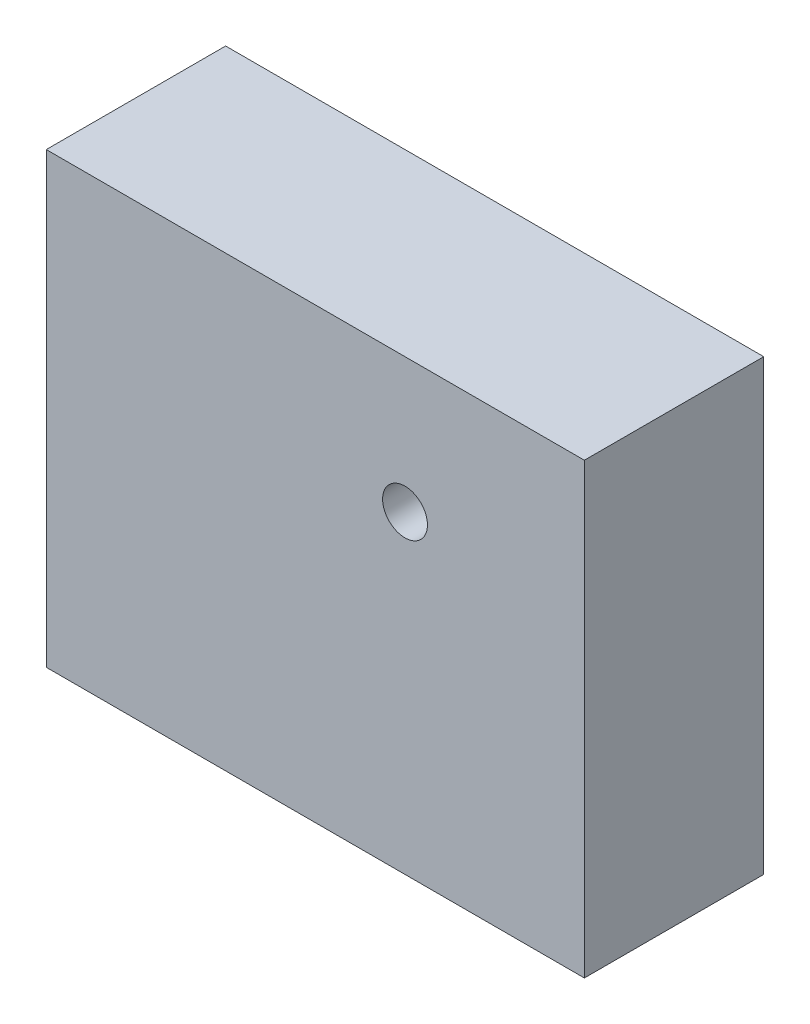
from build123d import *

# Parameters (mm, degrees)
SKIZZE1_W                       = 60
SKIZZE1_H                       = 50
AUFSATZ_LINEAR_AUSTRAGEN1_DEPTH = 20
SKIZZE2_R                       = 2.5
SCHNITT_LINEAR_AUSTRAGEN1_DEPTH = 12


with BuildPart() as part:
    # Skizze1 → Aufsatz-Linear austragen1 (new body)
    with BuildSketch(Plane.XY):
        Rectangle(SKIZZE1_W, SKIZZE1_H)
    extrude(amount=AUFSATZ_LINEAR_AUSTRAGEN1_DEPTH)

    # Skizze2 → Schnitt-Linear austragen1 (cut)
    with BuildSketch(Plane.XY.offset(20)):
        with Locations((10, 10)):
            Circle(SKIZZE2_R)
    extrude(amount=-SCHNITT_LINEAR_AUSTRAGEN1_DEPTH, mode=Mode.SUBTRACT)


solid = part.part
